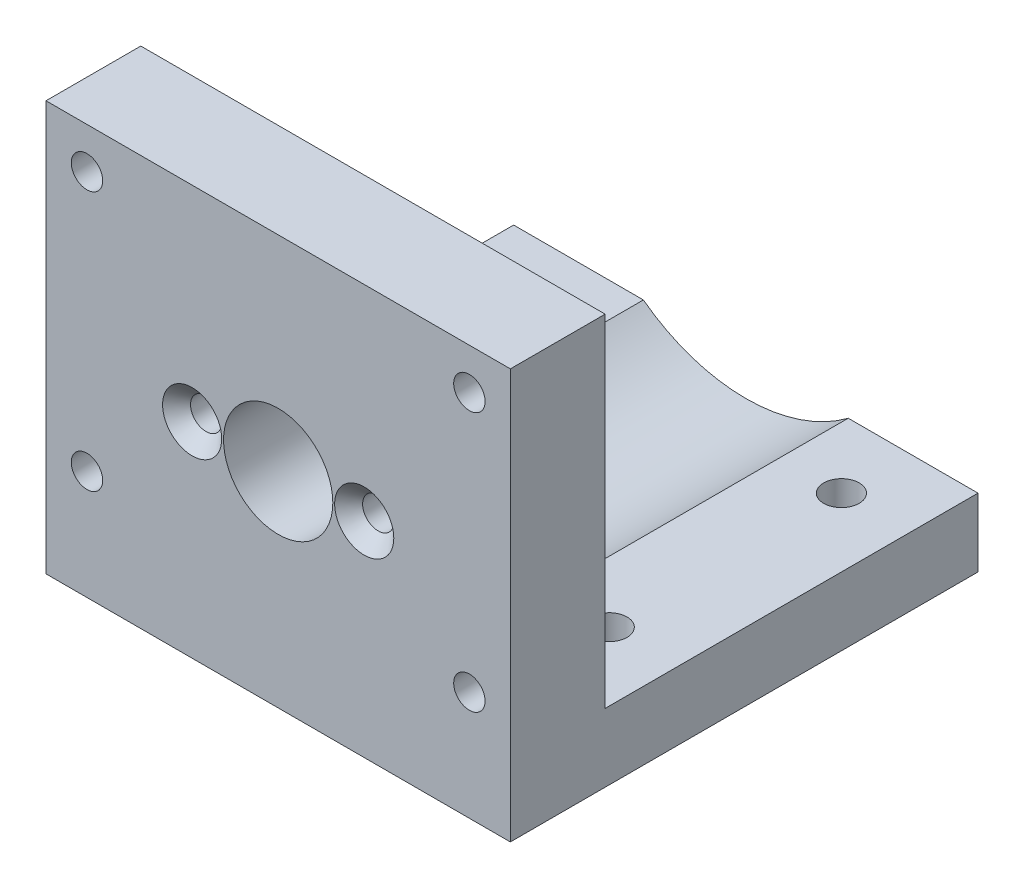
from build123d import *

# Parameters (mm, degrees)
SKETCH1_W                                         = 43.18
SKETCH1_H                                         = 43.4848
SKETCH1_R                                         = 1.651
BASE_LEG_DEPTH                                    = 6.35
SKETCH3_R                                         = 2.286
PERPENDICULAR_LEG_DEPTH                           = 8.8138
CSK_FOR_M2_5_FLAT_HEAD_MACHINE_SCREW1_D           = 2.9
CSK_FOR_M2_5_FLAT_HEAD_MACHINE_SCREW1_CSINK_D     = 5.5
CSK_FOR_M2_5_FLAT_HEAD_MACHINE_SCREW1_CSINK_ANGLE = 90
SKETCH10_R                                        = 1.4605
HOLES_FOR_STABILIZING_THROUGH_SHAFT_DEPTH         = 68.217561998
SKETCH11_R                                        = 15.875
CUT_EXTRUDE1_DEPTH                                = 68.217561998


with BuildPart() as part:
    # Sketch1 → Base leg (new body)
    with BuildSketch(Plane(origin=(0, 0, 0), x_dir=(1, 0, 0), z_dir=(0, 1, 0))):
        with Locations((21.59, 21.7424)):
            Rectangle(SKETCH1_W, SKETCH1_H)
        with Locations(Location((6.35, 37.1348, 0), (0, 0, 270))):
            Circle(SKETCH1_R, mode=Mode.SUBTRACT)
        with Locations(Location((36.83, 37.1348, 0), (0, 0, 270))):
            Circle(SKETCH1_R, mode=Mode.SUBTRACT)
        with Locations(Location((36.83, 15.5448, 0), (0, 0, 270))):
            Circle(SKETCH1_R, mode=Mode.SUBTRACT)
        with Locations(Location((6.35, 15.5448, 0), (0, 0, 270))):
            Circle(SKETCH1_R, mode=Mode.SUBTRACT)
    extrude(amount=BASE_LEG_DEPTH)

    # Sketch3 → Perpendicular leg (add)
    # profile 1 of 3: a face of its own
    with BuildSketch(Plane.XY):
        with BuildLine():
            Line((0, 6.35), (21.59, 6.35))
            Line((21.59, 6.35), (21.59, 13.97))
            ThreePointArc((21.59, 13.97), (16.51, 19.05), (21.59, 24.13))
            Line((21.59, 24.13), (21.59, 38.1))
            Line((21.59, 38.1), (0, 38.1))
            Line((0, 38.1), (0, 6.35))
        make_face()
        with Locations((3.302, 19.05)):
            Circle(SKETCH3_R, mode=Mode.SUBTRACT)
    # profile 2 of 3: a face of its own
    with BuildSketch(Plane.XY):
        with Locations((3.302, 19.05)):
            Circle(SKETCH3_R)
    # profile 3 of 3: a face of its own
    with BuildSketch(Plane.XY):
        with BuildLine():
            Line((21.59, 13.97), (21.59, 6.35))
            Line((21.59, 6.35), (43.18, 6.35))
            Line((43.18, 6.35), (43.18, 38.1))
            Line((43.18, 38.1), (21.59, 38.1))
            Line((21.59, 38.1), (21.59, 24.13))
            ThreePointArc((21.59, 24.13), (25.182102448, 22.642102448), (26.67, 19.05))
            ThreePointArc((26.67, 19.05), (25.182102448, 15.457897552), (21.59, 13.97))
        make_face()
    extrude(amount=-PERPENDICULAR_LEG_DEPTH)

    # CSK for M2.5 Flat Head Machine Screw1 (through all)
    with Locations(Plane.XY):
        with Locations((13.5900033, 19.05), (29.5899967, 19.05)):
            CounterSinkHole(CSK_FOR_M2_5_FLAT_HEAD_MACHINE_SCREW1_D / 2, CSK_FOR_M2_5_FLAT_HEAD_MACHINE_SCREW1_CSINK_D / 2, counter_sink_angle=CSK_FOR_M2_5_FLAT_HEAD_MACHINE_SCREW1_CSINK_ANGLE)

    # Sketch10 → Holes for stabilizing through shaft (cut, through all)
    with BuildSketch(Plane(origin=(0, 0, -8.8138), x_dir=(-1, 0, 0), z_dir=(0, 0, -1))):
        with Locations((-39.37, 34.29)):
            Circle(SKETCH10_R)
        with Locations((-39.37, 10.16)):
            Circle(SKETCH10_R)
        with Locations((-3.81, 34.29)):
            Circle(SKETCH10_R)
        with Locations((-3.81, 10.16)):
            Circle(SKETCH10_R)
    extrude(amount=-HOLES_FOR_STABILIZING_THROUGH_SHAFT_DEPTH, mode=Mode.SUBTRACT)

    # Sketch11 → Cut-Extrude1 (cut, through all)
    with BuildSketch(Plane(origin=(0, 0, -8.8138), x_dir=(-1, 0, 0), z_dir=(0, 0, -1))):
        with Locations((-21.59, 19.05)):
            Circle(SKETCH11_R)
    extrude(amount=CUT_EXTRUDE1_DEPTH, mode=Mode.SUBTRACT)


solid = part.part
